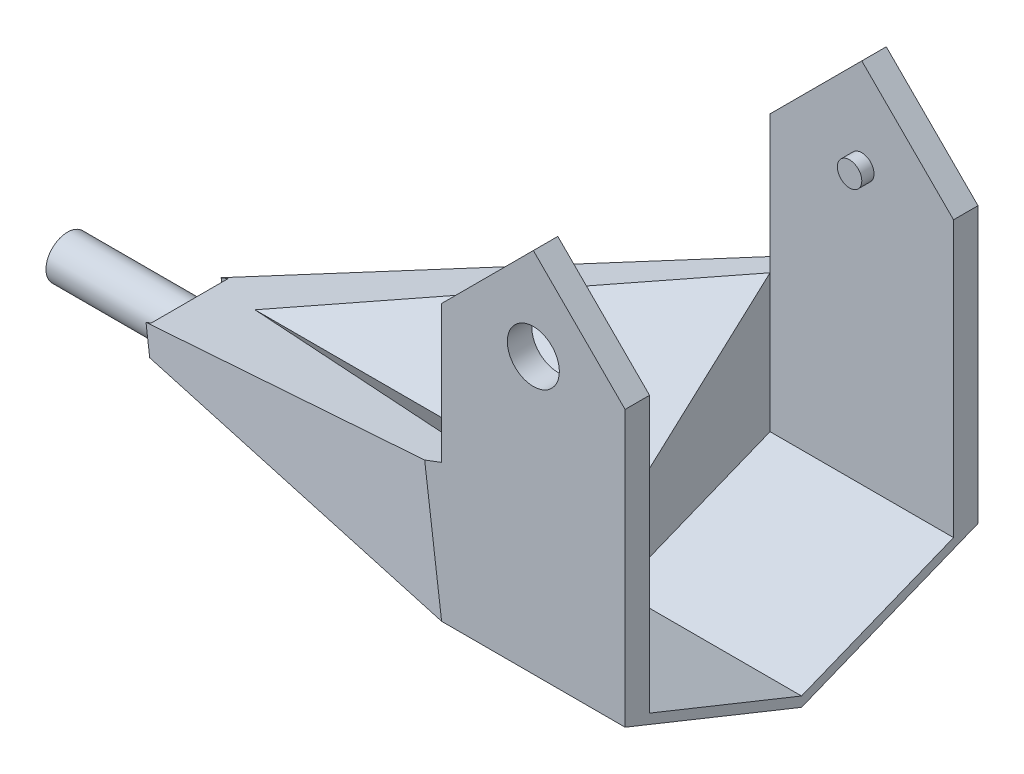
from build123d import *

# Parameters (mm, degrees)
SKETCH1_R                = 4.25
BOSS_EXTRUDE1_DEPTH      = 4
BOSS_EXTRUDE2_DEPTH      = 4
SKETCH3_R                = 2
BOSS_EXTRUDE3_DEPTH      = 2
BOSS_EXTRUDE4_DEPTH      = 53.7
BOSS_EXTRUDE4_DEPTH_BACK = 4
CUT_EXTRUDE1_DEPTH       = 53.7
BOSS_EXTRUDE5_DEPTH      = 120
CUT_EXTRUDE2_DEPTH       = 120
CUT_EXTRUDE2_DEPTH_BACK  = 120
BOSS_EXTRUDE6_DEPTH      = 53.7
BOSS_EXTRUDE6_DEPTH_BACK = 4
CUT_EXTRUDE3_DEPTH       = 53.7
CUT_EXTRUDE4_DEPTH       = 53.7
SKETCH18_W               = 12.575700543
SKETCH18_H               = 12.198178211
CUT_EXTRUDE9_DEPTH       = 98.7
BOSS_EXTRUDE7_DEPTH      = 20
CUT_EXTRUDE11_DEPTH      = 20
SKETCH22_R               = 3
CUT_EXTRUDE12_DEPTH      = 10
CUT_EXTRUDE13_DEPTH      = 99
CUT_EXTRUDE14_DEPTH      = 99
BOSS_EXTRUDE8_DEPTH      = 12


with BuildPart() as part:
    # Sketch1 → Boss-Extrude1 (new body)
    with BuildSketch(Plane.XY):
        Polygon((0, 10), (0, -15), (-30, -35), (-30, 10), (-15, 25), align=None)
        with Locations((-15, 10)):
            Circle(SKETCH1_R, mode=Mode.SUBTRACT)
    extrude(amount=BOSS_EXTRUDE1_DEPTH)



with BuildPart() as body_2:
    # Sketch2 → Boss-Extrude2 (new body)
    with BuildSketch(Plane.XY.offset(-49.7)):
        Polygon((-30, -35), (-30, 10), (-15, 25), (0, 10), (0, -15), align=None)
    extrude(amount=-BOSS_EXTRUDE2_DEPTH)

    # Sketch3 → Boss-Extrude3 (add)
    with BuildSketch(Plane.XY.offset(-49.7)):
        with Locations((-15, 10)):
            Circle(SKETCH3_R)
    extrude(amount=BOSS_EXTRUDE3_DEPTH)


with BuildPart() as part_1:
    add(part.part)

    add(body_2.part)  # Boss-Extrude4 merges body 2
    # Sketch4 → Boss-Extrude4 (add, two sides: drawn at the far end of the back side and taken through both)
    with BuildSketch(Plane.XY.offset(-49.7).offset(-BOSS_EXTRUDE4_DEPTH_BACK)):
        Polygon((-30, -35), (0, -35), (0, -15), align=None)
    extrude(amount=BOSS_EXTRUDE4_DEPTH + BOSS_EXTRUDE4_DEPTH_BACK)

    # Sketch5 → Cut-Extrude1 (cut)
    with BuildSketch(Plane(origin=(0, 0, 0), x_dir=(0, 0, -1), z_dir=(1, 0, 0))):
        Polygon((24.85, -15), (49.7, -15), (49.7, -35), (0, -35), (0, -15), align=None)
    extrude(amount=-CUT_EXTRUDE1_DEPTH, mode=Mode.SUBTRACT)


with BuildPart() as cut_extrude1_piece_1:
    # of the separate pieces the step leaves, piece 1, a body of its own (cut_extrude1_pieces)
    add(part_1.part.solids().sort_by_distance((-30, -35, -49.7))[0])



with BuildPart() as cut_extrude1_piece_2:
    # of the separate pieces the step leaves, piece 2, a body of its own (cut_extrude1_pieces)
    add(part_1.part.solids().sort_by_distance((0, -35, 0))[0])


with BuildPart() as cut_extrude1_piece_1_1:
    add(cut_extrude1_piece_1.part)

    add(cut_extrude1_piece_2.part)  # Boss-Extrude5 merges Cut-Extrude1 piece 2
    # Sketch6 → Boss-Extrude5 (add)
    with BuildSketch(Plane(origin=(0, 0, 0), x_dir=(0, 0, -1), z_dir=(1, 0, 0))):
        Polygon((0, -35), (-4, -35), (24.85, -46.609657949), (53.7, -35), (49.7, -35), (24.85, -45), align=None)
    extrude(amount=-BOSS_EXTRUDE5_DEPTH)

    # Sketch7 → Cut-Extrude2 (cut, two sides: drawn at the far end of the back side and taken through both)
    with BuildSketch(Plane.XY.offset(-49.7).offset(-CUT_EXTRUDE2_DEPTH_BACK)):
        Polygon((-30, -35), (-120, -35), (-120, -46.609657949), align=None)
    extrude(amount=CUT_EXTRUDE2_DEPTH + CUT_EXTRUDE2_DEPTH_BACK, mode=Mode.SUBTRACT)

    # Sketch8 → Boss-Extrude6 (add, two sides: drawn at the far end of the back side and taken through both)
    with BuildSketch(Plane.XY.offset(-49.7).offset(-BOSS_EXTRUDE6_DEPTH_BACK)):
        Polygon((-30, -35), (-30, -12.5), (-120, -46.609657949), align=None)
    extrude(amount=BOSS_EXTRUDE6_DEPTH + BOSS_EXTRUDE6_DEPTH_BACK)

    # Sketch9 → Cut-Extrude3 (cut)
    with BuildSketch(Plane(origin=(3.949939329, -30.620586856, 0), x_dir=(0.991782404932817, 0.12793616089940293, 0), z_dir=(0.12793616089940293, -0.991782404932817, 0))):
        Polygon((-124.976949291, -24.85), (-34.231237779, -53.7), (-124.976949291, -53.7), align=None)
    extrude(amount=-CUT_EXTRUDE3_DEPTH, mode=Mode.SUBTRACT)

    # Sketch10 → Cut-Extrude4 (cut)
    with BuildSketch(Plane(origin=(3.949939329, -30.620586856, 0), x_dir=(0.991782404932817, 0.12793616089940293, 0), z_dir=(0.12793616089940293, -0.991782404932817, 0))):
        Polygon((-124.976949291, -24.85), (-34.231237779, 4), (-124.976949291, 4), align=None)
    extrude(amount=-CUT_EXTRUDE4_DEPTH, mode=Mode.SUBTRACT)

    # Sketch18 → Cut-Extrude9 (cut)
    with BuildSketch(Plane(origin=(-100, 0, 0), x_dir=(0, 0, -1), z_dir=(1, 0, 0))):
        with Locations((24.80300407, -45.072632523)):
            Rectangle(SKETCH18_W, SKETCH18_H)
    extrude(amount=-CUT_EXTRUDE9_DEPTH, mode=Mode.SUBTRACT)

    # Sketch19 → Boss-Extrude7 (add)
    with BuildSketch(Plane.ZY.offset(100)):
        Polygon((-31.090854341, -39.02973396), (-31.090854341, -44.098247751), (-24.85, -46.609657949), (-18.515153798, -44.060424064), (-18.515153798, -39.02973396), align=None)
    extrude(amount=BOSS_EXTRUDE7_DEPTH)

    # Sketch20 → Cut-Extrude11 (cut)
    with BuildSketch(Plane.ZY.offset(120)):
        with BuildLine():
            Line((-18.515153798, -39.02973396), (-24.80300407, -39.02973396))
            Line((-24.80300407, -39.02973396), (-24.804747468, -39.310924888))
            ThreePointArc((-24.804747468, -39.310924888), (-22.337699017, -40.346275812), (-21.317663529, -42.819695955))
            ThreePointArc((-21.317663529, -42.819695955), (-21.889089638, -44.738955206), (-23.417250653, -46.033098856))
            Line((-23.417250653, -46.033098856), (-18.515153798, -44.060424064))
            Line((-18.515153798, -44.060424064), (-18.515153798, -39.02973396))
        make_face()
        with BuildLine():
            Line((-24.804747468, -39.310924888), (-24.80300407, -39.02973396))
            Line((-24.80300407, -39.02973396), (-31.090854341, -39.02973396))
            Line((-31.090854341, -39.02973396), (-31.090854341, -44.098247751))
            Line((-31.090854341, -44.098247751), (-24.85, -46.609657949))
            Line((-24.85, -46.609657949), (-24.848256601, -46.328467021))
            ThreePointArc((-24.848256601, -46.328467021), (-28.335273102, -42.797941388), (-24.804747468, -39.310924888))
        make_face()
        with BuildLine():
            ThreePointArc((-23.617143522, -46.113538642), (-24.223054162, -46.276254695), (-24.848256601, -46.328467021))
            Line((-24.848256601, -46.328467021), (-24.85, -46.609657949))
            Line((-24.85, -46.609657949), (-23.617143522, -46.113538642))
        make_face()
    extrude(amount=-CUT_EXTRUDE11_DEPTH, mode=Mode.SUBTRACT)

    # Sketch22 → Cut-Extrude12 (cut)
    with BuildSketch(Plane.ZY.offset(120)):
        with Locations((-24.826502035, -42.819695955)):
            Circle(SKETCH22_R)
    extrude(amount=-CUT_EXTRUDE12_DEPTH, mode=Mode.SUBTRACT)

    # Sketch23 → Cut-Extrude13 (cut)
    with BuildSketch(Plane(origin=(-30, 0, 0), x_dir=(0, 0, -1), z_dir=(1, 0, 0))):
        Polygon((0, -12.5), (24.300610602, -23.722317099), (49.7, -12.5), align=None)
    extrude(amount=-CUT_EXTRUDE13_DEPTH, mode=Mode.SUBTRACT)

    # Sketch24 → Cut-Extrude14 (cut)
    with BuildSketch(Plane(origin=(-30, 0, 0), x_dir=(0, 0, -1), z_dir=(1, 0, 0))):
        Polygon((0, -12.5), (24.85, -35), (49.7, -12.5), (24.300610602, -23.722317099), align=None)
    extrude(amount=-CUT_EXTRUDE14_DEPTH, mode=Mode.SUBTRACT)

    # Sketch25 → Boss-Extrude8 (add)
    with BuildSketch(Plane(origin=(-30, 0, 0), x_dir=(0, 0, -1), z_dir=(1, 0, 0))):
        Polygon((0, -35), (49.7, -35), (24.85, -45), align=None)
    extrude(amount=-BOSS_EXTRUDE8_DEPTH)


solid = cut_extrude1_piece_1_1.part
